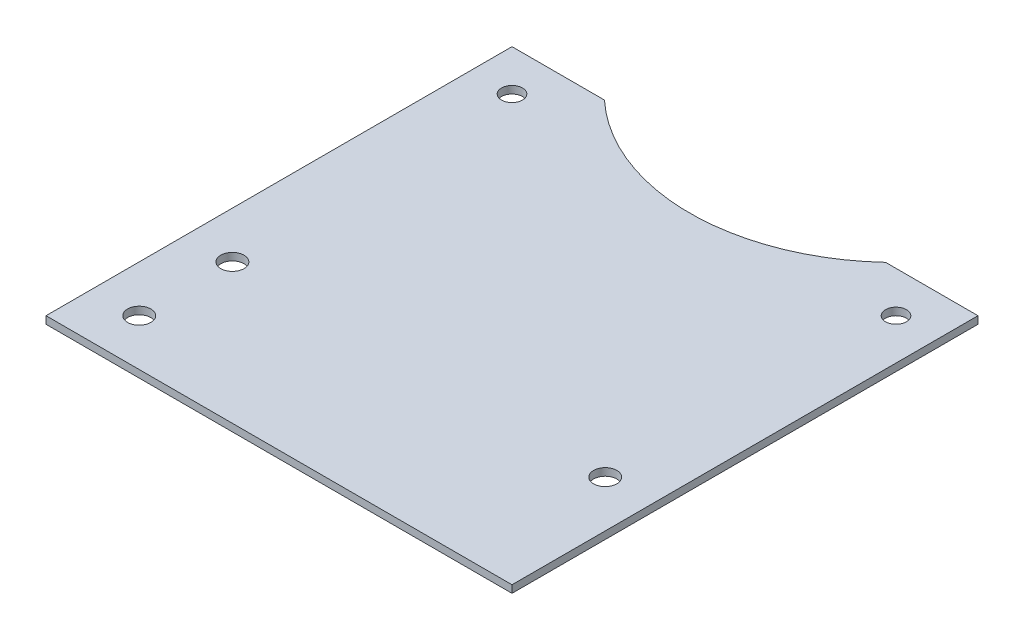
from build123d import *

# Parameters (mm, degrees)
SKETCH1_W           = 100
SKETCH1_H           = 100
SKETCH1_R           = 2.5
SKETCH1_R_2         = 2.25
BOSS_EXTRUDE1_DEPTH = 0.8
SKETCH2_R           = 44.3
CUT_EXTRUDE1_DEPTH  = 71.728777736


with BuildPart() as part:
    # Sketch1 → Boss-Extrude1 (new, symmetric)
    with BuildSketch(Plane(origin=(0, 0, 0), x_dir=(1, 0, 0), z_dir=(0, 1, 0))):
        Rectangle(SKETCH1_W, SKETCH1_H)
        with Locations((-40, -40)):
            Circle(SKETCH1_R, mode=Mode.SUBTRACT)
        with Locations((-40, -20)):
            Circle(SKETCH1_R, mode=Mode.SUBTRACT)
        with Locations((40, -20)):
            Circle(SKETCH1_R, mode=Mode.SUBTRACT)
        with Locations((-41.2, 41.2)):
            Circle(SKETCH1_R_2, mode=Mode.SUBTRACT)
        with Locations((41.2, 41.2)):
            Circle(SKETCH1_R_2, mode=Mode.SUBTRACT)
    extrude(amount=BOSS_EXTRUDE1_DEPTH, both=True)

    # Sketch2 → Cut-Extrude1 (cut, through all)
    with BuildSketch(Plane(origin=(0, 0.8, 0), x_dir=(1, 0, 0), z_dir=(0, 1, 0))):
        with Locations((0, 82.44)):
            Circle(SKETCH2_R)
    extrude(amount=-CUT_EXTRUDE1_DEPTH, mode=Mode.SUBTRACT)


solid = part.part
